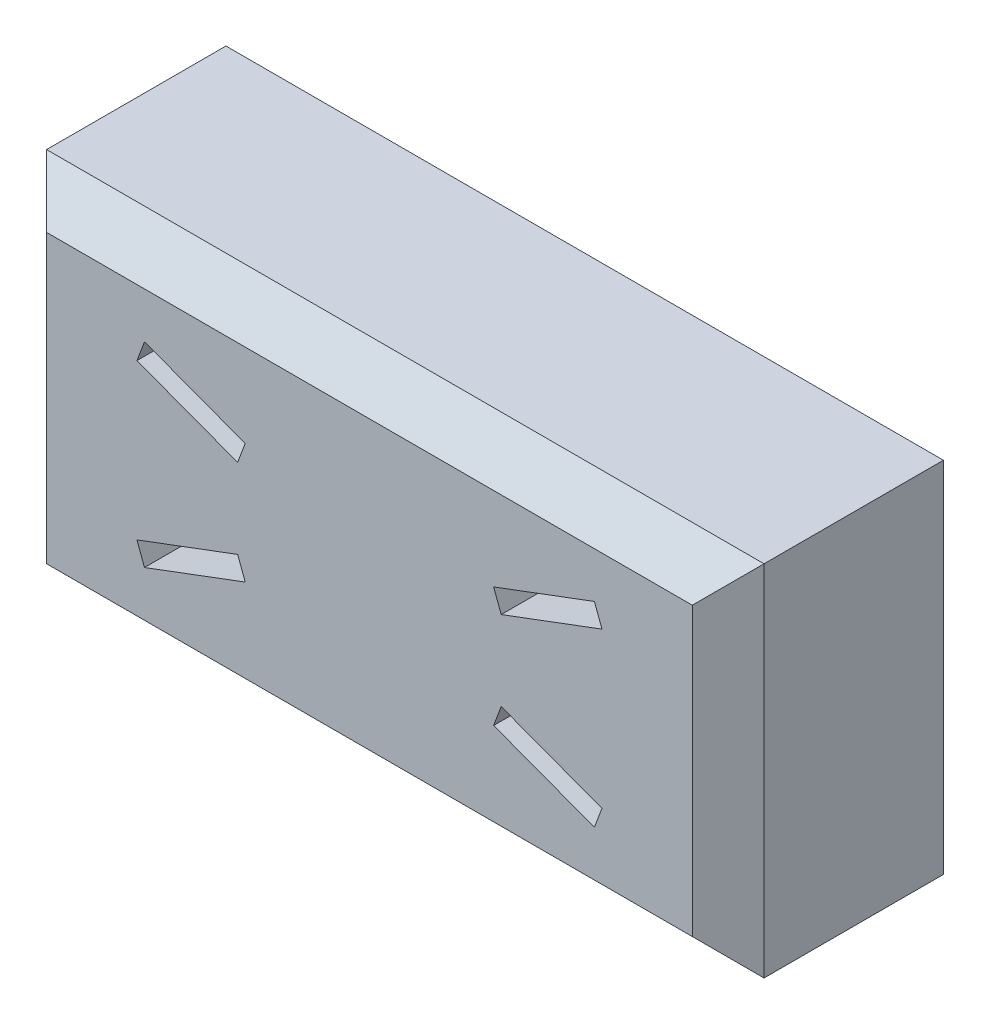
from build123d import *

# Parameters (mm, degrees)
SKETCH_1_W          = 10
SKETCH_1_H          = 5
EXTRUDE_1_DEPTH     = 3
CHAMFER_1_SIZE      = 0.5
CUT_EXTRUDE_1_DEPTH = 1


with BuildPart() as part:
    # 草图1 → 凸台-拉伸1 (new body)
    with BuildSketch(Plane.XY):
        Rectangle(SKETCH_1_W, SKETCH_1_H)
    extrude(amount=EXTRUDE_1_DEPTH)

    # 倒角1
    chamfer_1_edges = [part.edges().sort_by_distance(p)[0] for p in [
        (-5, 0, 3),
        (0, -2.5, 3),
        (5, 0, 3),
        (0, 2.5, 3),
    ]]
    chamfer(chamfer_1_edges, length=CHAMFER_1_SIZE)

    # 草图2 → 切除-拉伸1 (cut)
    with BuildSketch(Plane.XY.offset(3)):
        Polygon((1.731172959, 0.836187535), (1.836509992, 0.555288782), (3.241003758, 1.081973944), (3.135666725, 1.362872698), align=None)
        Polygon((-1.731172959, 0.836187535), (-3.135666725, 1.362872698), (-3.241003758, 1.081973944), (-1.836509992, 0.555288782), align=None)
        Polygon((1.731172959, -0.836187535), (3.135666725, -1.362872698), (3.241003758, -1.081973944), (1.836509992, -0.555288782), align=None)
        Polygon((-1.731172959, -0.836187535), (-1.836509992, -0.555288782), (-3.241003758, -1.081973944), (-3.135666725, -1.362872698), align=None)
    extrude(amount=-CUT_EXTRUDE_1_DEPTH, mode=Mode.SUBTRACT)


solid = part.part
